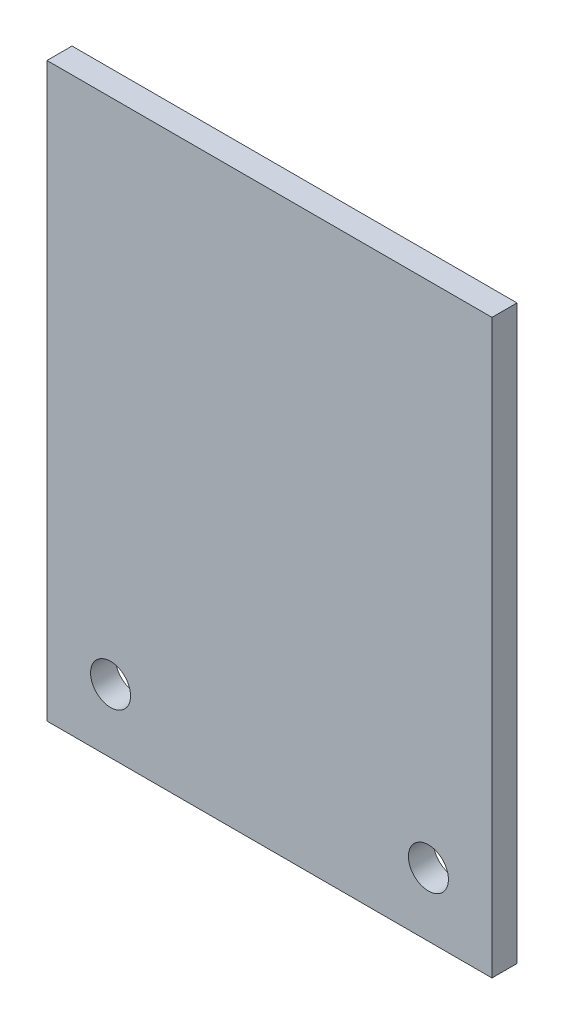
from build123d import *

# Parameters (mm, degrees)
SKETCH1_W           = 34.29
SKETCH1_H           = 26.67
SKETCH1_R           = 1.2
BOSS_EXTRUDE1_DEPTH = 1.5


with BuildPart() as part:
    # Sketch1 → Boss-Extrude1 (new body)
    with BuildSketch(Plane(origin=(0, 0, 0), x_dir=(0, 1, 0), z_dir=(0, 0, 1))):
        Rectangle(SKETCH1_W, SKETCH1_H)
        with Locations(Location((-13.335, 9.525, 0), (0, 0, 270))):
            Circle(SKETCH1_R, mode=Mode.SUBTRACT)
        with Locations(Location((-13.335, -9.525, 0), (0, 0, 90))):
            Circle(SKETCH1_R, mode=Mode.SUBTRACT)
    extrude(amount=BOSS_EXTRUDE1_DEPTH)


solid = part.part
